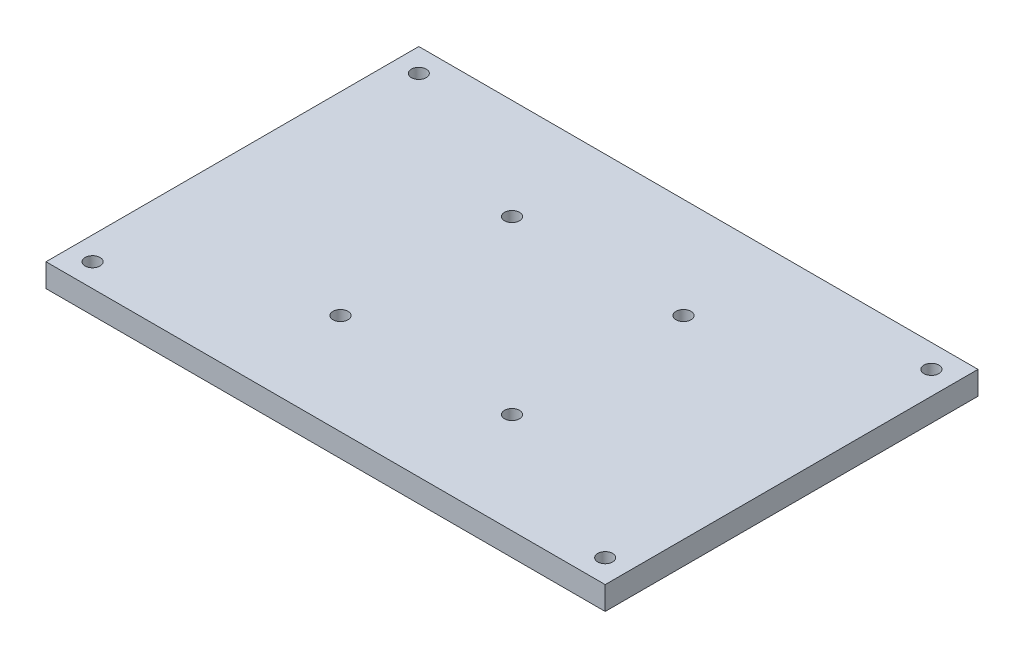
from build123d import *

# Parameters (mm, degrees)
ESQUISSE1_W             = 120
ESQUISSE1_H             = 80
BOSS_EXTRU_1_DEPTH      = 5
ESQUISSE2_R             = 1.6
ENL_V_MAT_EXTRU_1_DEPTH = 145.308696897


with BuildPart() as part:
    # Esquisse1 → Boss.-Extru.1 (new body)
    with BuildSketch(Plane(origin=(0, 0, 0), x_dir=(1, 0, 0), z_dir=(0, 1, 0))):
        with Locations((60, 40)):
            Rectangle(ESQUISSE1_W, ESQUISSE1_H)
    extrude(amount=BOSS_EXTRU_1_DEPTH)

    # Esquisse2 → Enlèv. mat.-Extru.1 (cut, through all)
    with BuildSketch(Plane(origin=(0, 5, 0), x_dir=(1, 0, 0), z_dir=(0, 1, 0))):
        with Locations(Location((5, 75, 0), (0, 0, 270))):
            Circle(ESQUISSE2_R)
        with Locations(Location((115, 75, 0), (0, 0, 90))):
            Circle(ESQUISSE2_R)
        with Locations(Location((115, 5, 0), (0, 0, 270))):
            Circle(ESQUISSE2_R)
        with Locations(Location((5, 5, 0), (0, 0, 90))):
            Circle(ESQUISSE2_R)
        with Locations(Location((41.6, 58.4, 0), (0, 0, 270))):
            Circle(ESQUISSE2_R)
        with Locations(Location((41.6, 21.6, 0), (0, 0, 90))):
            Circle(ESQUISSE2_R)
        with Locations(Location((78.4, 21.6, 0), (0, 0, 270))):
            Circle(ESQUISSE2_R)
        with Locations(Location((78.4, 58.4, 0), (0, 0, 90))):
            Circle(ESQUISSE2_R)
    extrude(amount=-ENL_V_MAT_EXTRU_1_DEPTH, mode=Mode.SUBTRACT)


solid = part.part
